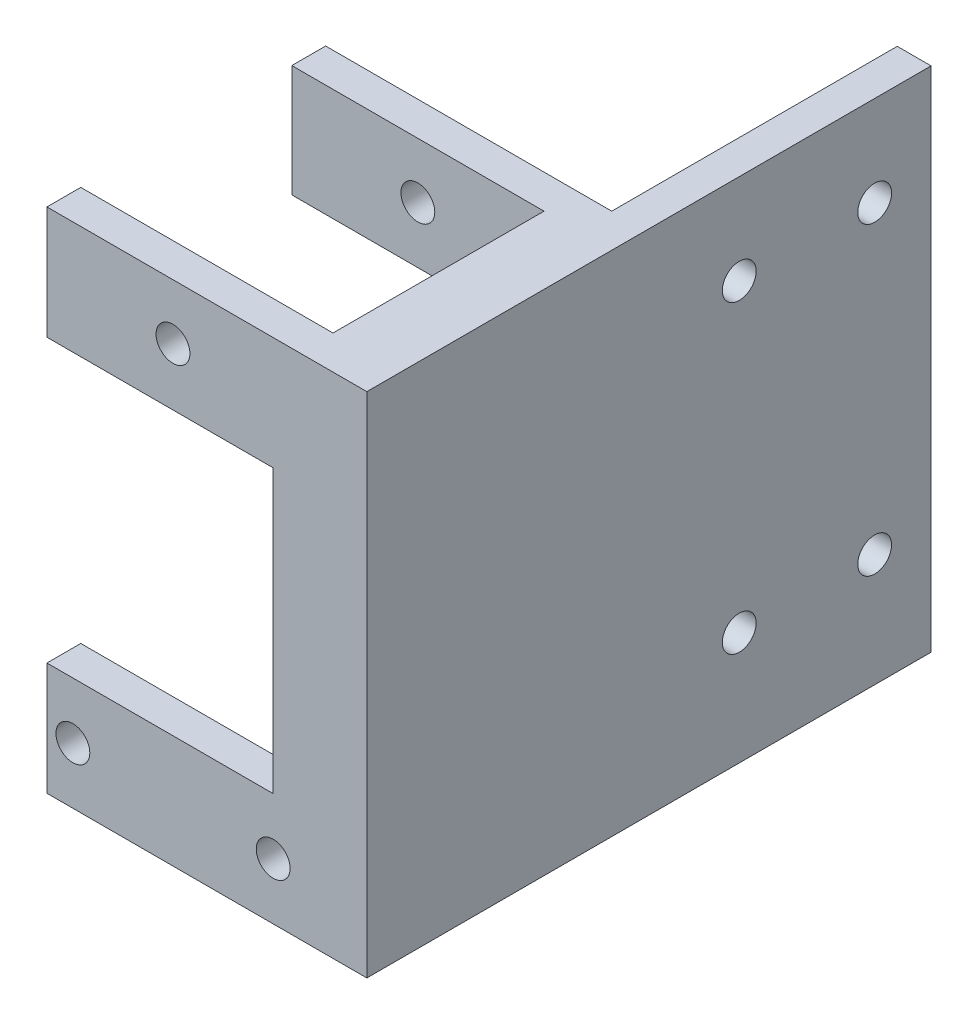
from build123d import *

# Parameters (mm, degrees)
SKETCH2_W           = 5.3
SKETCH2_H           = 25
SKETCH2_R           = 1.5
BOSS_EXTRUDE1_DEPTH = 3
SKETCH3_W           = 50
SKETCH3_H           = 45
BOSS_EXTRUDE2_DEPTH = 3
SKETCH7_W           = 38.35
SKETCH7_H           = 3
BOSS_EXTRUDE3_DEPTH = 45
CUT_EXTRUDE1_DEPTH  = 5
SKETCH8_3_R         = 1.5
CUT_EXTRUDE2_DEPTH  = 5
SKETCH11_R          = 1.5
CUT_EXTRUDE4_DEPTH  = 5
SKETCH12_W          = 18.7
SKETCH12_H          = 45
BOSS_EXTRUDE4_DEPTH = 3


with BuildPart() as part:
    # Sketch2 → Boss-Extrude1 (new body)
    # profile 1 of 3: a face of its own
    with BuildSketch(Plane.XY):
        with Locations((10.025, 0)):
            Rectangle(SKETCH2_W, SKETCH2_H)
    # profile 2 of 3: a face of its own
    with BuildSketch(Plane.XY):
        Polygon((7.375, 12.5), (12.675, 12.5), (12.675, 22.5), (-12.675, 22.5), (-12.675, 12.5), align=None)
        with Locations((-1.505, 17.58)):
            Circle(SKETCH2_R, mode=Mode.SUBTRACT)
    # profile 3 of 3: a face of its own
    with BuildSketch(Plane.XY):
        Polygon((-12.675, -22.5), (12.675, -22.5), (12.675, -12.5), (7.375, -12.5), (-12.675, -12.5), align=None)
        with Locations((-10.375, -17.5)):
            Circle(SKETCH2_R, mode=Mode.SUBTRACT)
        with Locations((7.375, -17.5)):
            Circle(SKETCH2_R, mode=Mode.SUBTRACT)
    extrude(amount=-BOSS_EXTRUDE1_DEPTH)

    # Sketch3 → Boss-Extrude2 (add)
    with BuildSketch(Plane(origin=(12.675, 0, 0), x_dir=(0, 0, -1), z_dir=(1, 0, 0))):
        with Locations((25, 0)):
            Rectangle(SKETCH3_W, SKETCH3_H)
    extrude(amount=BOSS_EXTRUDE2_DEPTH)

    # Sketch7 → Boss-Extrude3 (add)
    with BuildSketch(Plane(origin=(0, 22.5, 0), x_dir=(1, 0, 0), z_dir=(0, 1, 0))):
        with Locations((-3.5, 23.2)):
            Rectangle(SKETCH7_W, SKETCH7_H)
    extrude(amount=-BOSS_EXTRUDE3_DEPTH)

    # Sketch8 → Cut-Extrude1 (cut)
    with BuildSketch(Plane.XY.offset(-21.7)):
        Polygon((-12.675, 12.572802409), (-12.675, 22.5), (-22.675, 22.5), (-22.675, -22.5), (-12.675, -22.5), (-12.675, -12.5), (7.375, -12.5), (7.375, 12.572802409), align=None)
    extrude(amount=-CUT_EXTRUDE1_DEPTH, mode=Mode.SUBTRACT)

    # Sketch8<3> → Cut-Extrude2 (cut)
    with BuildSketch(Plane.XY.offset(-21.7)):
        with Locations((-1.505, 17.58)):
            Circle(SKETCH8_3_R)
        with Locations((-10.375, -17.5)):
            Circle(SKETCH8_3_R)
        with Locations((7.375, -17.5)):
            Circle(SKETCH8_3_R)
    extrude(amount=-CUT_EXTRUDE2_DEPTH, mode=Mode.SUBTRACT)

    # Sketch11 → Cut-Extrude4 (cut)
    with BuildSketch(Plane(origin=(15.675, 0, 0), x_dir=(0, 0, -1), z_dir=(1, 0, 0))):
        with Locations((33, 14.5)):
            Circle(SKETCH11_R)
        with Locations((45, 14.5)):
            Circle(SKETCH11_R)
        with Locations((33, -12.5)):
            Circle(SKETCH11_R)
        with Locations((45, -12.5)):
            Circle(SKETCH11_R)
    extrude(amount=-CUT_EXTRUDE4_DEPTH, mode=Mode.SUBTRACT)

    # Sketch12 → Boss-Extrude4 (add)
    with BuildSketch(Plane.ZY.offset(-12.675)):
        with Locations((-12.35, 0)):
            Rectangle(SKETCH12_W, SKETCH12_H)
    extrude(amount=BOSS_EXTRUDE4_DEPTH)


solid = part.part
